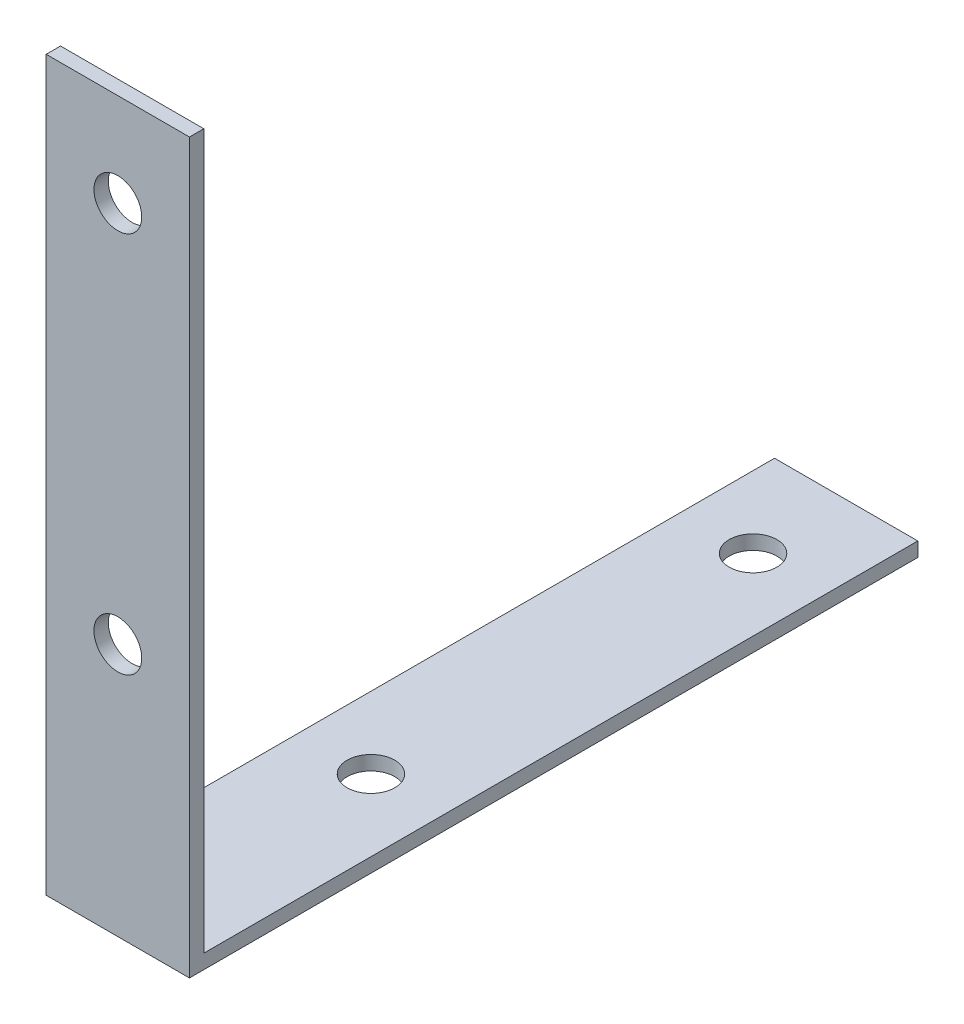
from build123d import *

# Parameters (mm, degrees)
EXTRUDE_1_DEPTH     = 12
SKETCH_2_R          = 2
CUT_EXTRUDE_1_DEPTH = 12
SKETCH_3_R          = 2
CUT_EXTRUDE_2_DEPTH = 12


with BuildPart() as part:
    # 草图1 → 凸台-拉伸1 (new body)
    with BuildSketch(Plane(origin=(0, 0, 0), x_dir=(0, 0, -1), z_dir=(1, 0, 0))):
        Polygon((0, 0), (61, 0), (61, 1.2), (1.2, 1.2), (1.2, 61), (0, 61), align=None)
    extrude(amount=EXTRUDE_1_DEPTH)

    # 草图2 → 切除-拉伸1 (cut)
    with BuildSketch(Plane(origin=(0, 1.2, 0), x_dir=(1, 0, 0), z_dir=(0, 1, 0))):
        with Locations(Location((6, 21.2, 0), (0, 0, 270))):
            Circle(SKETCH_2_R)
        with Locations(Location((6, 53.2, 0), (0, 0, 270))):
            Circle(SKETCH_2_R)
    extrude(amount=-CUT_EXTRUDE_1_DEPTH, mode=Mode.SUBTRACT)

    # 草图3 → 切除-拉伸2 (cut)
    with BuildSketch(Plane(origin=(0, 0, -1.2), x_dir=(-1, 0, 0), z_dir=(0, 0, -1))):
        with Locations(Location((-6, 21.2, 0), (0, 0, 90))):
            Circle(SKETCH_3_R)
        with Locations(Location((-6, 53.2, 0), (0, 0, 90))):
            Circle(SKETCH_3_R)
    extrude(amount=-CUT_EXTRUDE_2_DEPTH, mode=Mode.SUBTRACT)


solid = part.part
